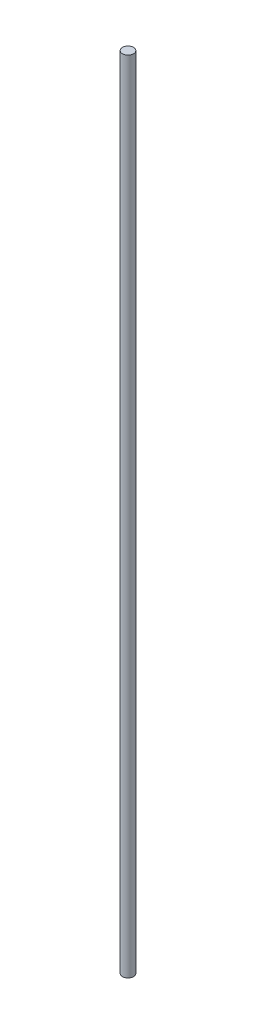
from build123d import *

# Parameters (mm, degrees)
BOSS_EXTRUDE1_DEPTH      = 180
BOSS_EXTRUDE1_DEPTH_BACK = 180
SKETCH1_R                = 2.5


with BuildPart() as part:
    # Sketch1 → Boss-Extrude1 (new, two sides: drawn at the far end of the back side and taken through both)
    with BuildSketch(Plane(origin=(0, 0, 0), x_dir=(1, 0, 0), z_dir=(0, 1, 0)).offset(-BOSS_EXTRUDE1_DEPTH_BACK)):
        Circle(SKETCH1_R)
    extrude(amount=BOSS_EXTRUDE1_DEPTH + BOSS_EXTRUDE1_DEPTH_BACK)


solid = part.part
